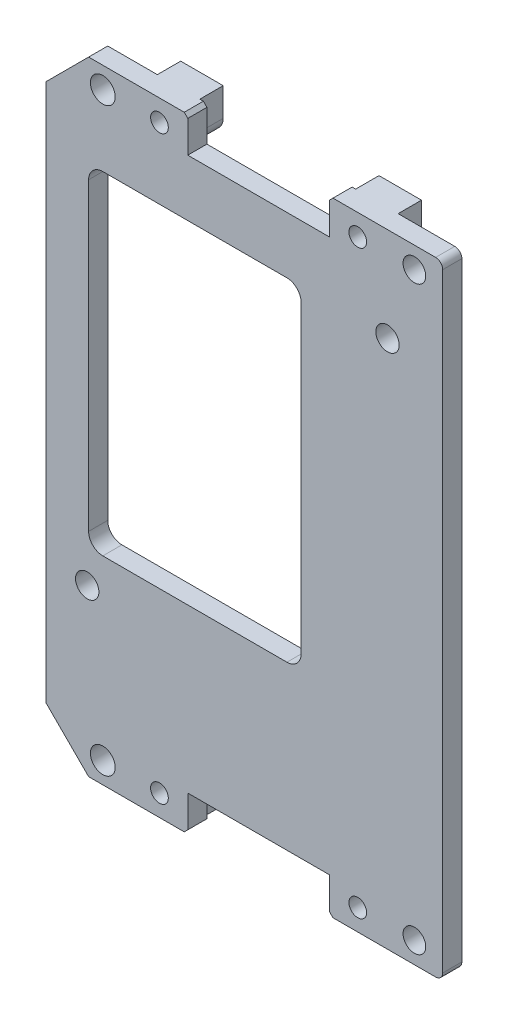
from build123d import *

# Parameters (mm, degrees)
SKETCH_1_W             = 56
SKETCH_1_H             = 88
EXTRUDE_1_DEPTH        = 2.7
FILLET_1_R             = 1
SKETCH_8_R             = 1.6
SKETCH_8_R_2           = 1.75
CUT_EXTRUDE_1_DEPTH    = 10
CHAMFER_1_SIZE         = 6
SKETCH_16_R            = 3
EXTRUDE_3_DEPTH        = 1
HOLE_WIZARD_M4_1_D     = 3.3
HOLE_WIZARD_M4_1_DEPTH = 10.1
HOLE_WIZARD_M4_1_TIP   = 0.991420021
SKETCH_11_W            = 6
SKETCH_11_H            = 6
EXTRUDE_2_DEPTH        = 3.3
HOLE_WIZARD_M3_1_D     = 2.5
HOLE_WIZARD_M3_1_DEPTH = 7.5
HOLE_WIZARD_M3_1_TIP   = 0.751075774
SKETCH_14_W            = 30
SKETCH_14_H            = 47
CUT_EXTRUDE_2_DEPTH    = 10
FILLET_2_R             = 2
SKETCH_15_W            = 20
SKETCH_15_H            = 2.7
CUT_EXTRUDE_3_DEPTH    = 5
CHAMFER_2_SIZE         = 0.5
FILLET_3_R             = 2


with BuildPart() as part:
    # 草图1 → 凸台-拉伸1 (new body)
    with BuildSketch(Plane.XY):
        Rectangle(SKETCH_1_W, SKETCH_1_H)
    extrude(amount=EXTRUDE_1_DEPTH)

    # 圆角1
    fillet_1_edges = [part.edges().sort_by_distance(p)[0] for p in [
        (28, -44, 1.35),
        (28, 44, 1.35),
    ]]
    fillet(fillet_1_edges, radius=FILLET_1_R)

    # 草图8 → 切除-拉伸1 (cut)
    with BuildSketch(Plane(origin=(0, 0, 0), x_dir=(-1, 0, 0), z_dir=(0, 0, -1))):
        with Locations((-24, 41)):
            Circle(SKETCH_8_R)
        with Locations((20, 41)):
            Circle(SKETCH_8_R_2)
        with Locations((-24, -41)):
            Circle(SKETCH_8_R)
        with Locations((20, -41)):
            Circle(SKETCH_8_R_2)
    extrude(amount=-CUT_EXTRUDE_1_DEPTH, mode=Mode.SUBTRACT)

    # 倒角1
    chamfer_1_edges = [part.edges().sort_by_distance(p)[0] for p in [
        (-28, -44, 1.35),
        (-28, 44, 1.35),
    ]]
    chamfer(chamfer_1_edges, length=CHAMFER_1_SIZE)

    # 草图16 → 凸台-拉伸3 (add)
    with BuildSketch(Plane(origin=(0, 0, 0), x_dir=(-1, 0, 0), z_dir=(0, 0, -1))):
        with Locations((22.2, -20.7)):
            Circle(SKETCH_16_R)
        with Locations((-20.2, 30.7)):
            Circle(SKETCH_16_R)
    extrude(amount=EXTRUDE_3_DEPTH)

    # M4 螺纹孔1
    with Locations(Plane.XY.offset(2.7)):
        with Locations((20.2, 30.7), (-22.2, -20.7)):
            Hole(HOLE_WIZARD_M4_1_D / 2, depth=HOLE_WIZARD_M4_1_DEPTH)
            with Locations((0, 0, -(HOLE_WIZARD_M4_1_DEPTH + HOLE_WIZARD_M4_1_TIP / 2))):  # 118° drill point
                Cone(0, HOLE_WIZARD_M4_1_D / 2, HOLE_WIZARD_M4_1_TIP, mode=Mode.SUBTRACT)

    # 草图11 → 凸台-拉伸2 (add)
    with BuildSketch(Plane(origin=(0, 0, 0), x_dir=(-1, 0, 0), z_dir=(0, 0, -1))):
        with Locations((-16, 41)):
            Rectangle(SKETCH_11_W, SKETCH_11_H)
        with Locations((12, 41)):
            Rectangle(SKETCH_11_W, SKETCH_11_H)
        with Locations((-16, -41)):
            Rectangle(SKETCH_11_W, SKETCH_11_H)
        with Locations((12, -41)):
            Rectangle(SKETCH_11_W, SKETCH_11_H)
    extrude(amount=EXTRUDE_2_DEPTH)

    # M3 螺纹孔1
    with Locations(Plane(origin=(0, 0, -3.3), x_dir=(-1, 0, 0), z_dir=(0, 0, -1))):
        with Locations((-16, 41), (12, 41), (-16, -41), (12, -41)):
            Hole(HOLE_WIZARD_M3_1_D / 2, depth=HOLE_WIZARD_M3_1_DEPTH)
            with Locations((0, 0, -(HOLE_WIZARD_M3_1_DEPTH + HOLE_WIZARD_M3_1_TIP / 2))):  # 118° drill point
                Cone(0, HOLE_WIZARD_M3_1_D / 2, HOLE_WIZARD_M3_1_TIP, mode=Mode.SUBTRACT)

    # 草图14 → 切除-拉伸2 (cut)
    with BuildSketch(Plane(origin=(0, 0, 0), x_dir=(-1, 0, 0), z_dir=(0, 0, -1))):
        with Locations((7, 7.5)):
            Rectangle(SKETCH_14_W, SKETCH_14_H)
    extrude(amount=-CUT_EXTRUDE_2_DEPTH, mode=Mode.SUBTRACT)

    # 圆角2
    fillet_2_edges = [part.edges().sort_by_distance(p)[0] for p in [
        (8, -16, 1.35),
        (8, 31, 1.35),
        (-22, 31, 1.35),
        (-22, -16, 1.35),
    ]]
    fillet(fillet_2_edges, radius=FILLET_2_R)

    # 草图15 → 切除-拉伸3 (cut)
    with BuildSketch(Plane.XZ.offset(44)):
        with Locations((2, 1.35)):
            Rectangle(SKETCH_15_W, SKETCH_15_H)
    cut_extrude_3 = extrude(amount=-CUT_EXTRUDE_3_DEPTH, mode=Mode.SUBTRACT)

    # 镜向2: 切除-拉伸3 across plane
    add(cut_extrude_3.mirror(Plane(origin=(0, 0, 0), x_dir=(0, 0, 1), z_dir=(0, -1, 0))), mode=Mode.SUBTRACT)

    # 倒角2
    chamfer_2_edges = [part.edges().sort_by_distance(p)[0] for p in [
        (12, -44, 1.35),
        (-8, -44, 1.35),
        (12, 44, 1.35),
        (-8, 44, 1.35),
    ]]
    chamfer(chamfer_2_edges, length=CHAMFER_2_SIZE)

    # 圆角3
    fillet_3_edges = [part.edges().sort_by_distance(p)[0] for p in [
        (19, -38, -1.65),
        (13, -38, -1.65),
        (-9, -38, -1.65),
        (-15, -38, -1.65),
        (19, 38, -1.65),
        (13, 38, -1.65),
        (-9, 38, -1.65),
        (-15, 38, -1.65),
    ]]
    fillet(fillet_3_edges, radius=FILLET_3_R)


solid = part.part
